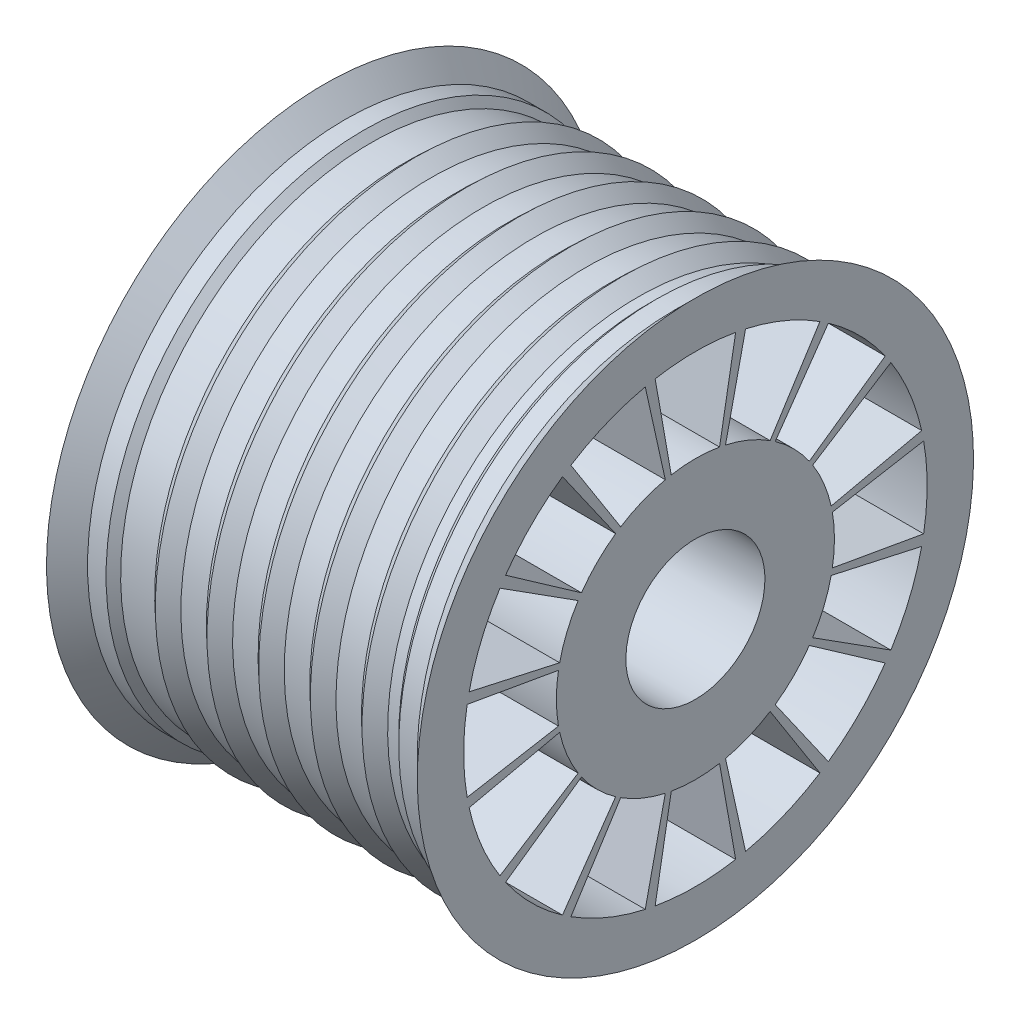
from build123d import *

# Parameters (mm, degrees)
SKETCH3_R             = 7.5
CUT_EXTRUDE1_DEPTH    = 59.309518948
CUT_EXTRUDE4_DEPTH    = 10
CIRPATTERN1_COUNT     = 16
MIRROR2_COPY_1_DEPTH  = 10
MIRROR2_COPY_2_DEPTH  = 10
MIRROR2_COPY_3_DEPTH  = 10
MIRROR2_COPY_4_DEPTH  = 10
MIRROR2_COPY_5_DEPTH  = 10
MIRROR2_COPY_6_DEPTH  = 10
MIRROR2_COPY_7_DEPTH  = 10
MIRROR2_COPY_8_DEPTH  = 10
MIRROR2_COPY_9_DEPTH  = 10
MIRROR2_COPY_10_DEPTH = 10
MIRROR2_COPY_11_DEPTH = 10
MIRROR2_COPY_12_DEPTH = 10
MIRROR2_COPY_13_DEPTH = 10
MIRROR2_COPY_14_DEPTH = 10
MIRROR2_COPY_15_DEPTH = 10
MIRROR2_COPY_16_DEPTH = 10


with BuildPart() as part:
    # Sketch2 → Revolve1 (revolve)
    with BuildSketch(Plane.XY, mode=Mode.PRIVATE) as revolve1_sk:
        Polygon((-20, 0), (-20, 30), (-17.785695345, 27.785695345), (-15.785695345, 27.785695345), (-15, 27), (-11.327571232, 27), (-10.234854429, 28.027604003), (-8.502421292, 27), (-5.751649629, 27), (-4.658932826, 28.027604003), (-2.926499689, 27), (-0.175728026, 27), (0.916988778, 28.027604003), (2.649421915, 27), (5.400193578, 27), (6.492910381, 28.027604003), (8.225343518, 27), (10.976115181, 27), (12.068831985, 28.027604003), (13.801265122, 27), (15, 27), (15.785695345, 27.785695345), (17.785695345, 27.785695345), (20, 30), (20, 0), align=None)
    revolve(revolve1_sk.sketch.rotate(Axis((-20, 0, 0), (1, 0, 0)), 180), axis=Axis((-20, 0, 0), (1, 0, 0)))

    # Sketch3 → Cut-Extrude1 (cut, through all)
    with BuildSketch(Plane.ZY.offset(20)):
        with Locations(Location((0, 0, 0), (0, 0, 270))):
            Circle(SKETCH3_R)
    extrude(amount=-CUT_EXTRUDE1_DEPTH, mode=Mode.SUBTRACT)

    # Sketch4 → Cut-Extrude4 (cut)
    with BuildSketch(Plane.ZY.offset(20)):
        with BuildLine():
            Line((-2.604722665, 14.772116295), (-4.341204442, 24.620193825))
            ThreePointArc((-4.341204442, 24.620193825), (0, 25), (4.341204442, 24.620193825))
            Line((4.341204442, 24.620193825), (2.604722665, 14.772116295))
            ThreePointArc((2.604722665, 14.772116295), (0, 15), (-2.604722665, 14.772116295))
        make_face()
    cut_extrude4 = extrude(amount=-CUT_EXTRUDE4_DEPTH, mode=Mode.SUBTRACT)

    # CirPattern1: Cut-Extrude4 ×16 about axis
    cirpattern1_axis = Axis((0, 0, 0), (1, 0, 0))
    for i in range(1, CIRPATTERN1_COUNT):
        add(cut_extrude4.rotate(cirpattern1_axis, i * 360 / CIRPATTERN1_COUNT), mode=Mode.SUBTRACT)

    # Mirror1: Cut-Extrude4 across plane
    add(cut_extrude4.mirror(Plane(origin=(0, 0, 0), x_dir=(0, 0, 1), z_dir=(1, 0, 0))), mode=Mode.SUBTRACT)

    # Mirror2 copy 1 sketch → Mirror2 copy 1 (cut)
    with BuildSketch(Plane(origin=(20, 0, 0), x_dir=(0, -0.3826834323650898, 0.9238795325112867), z_dir=(1, 0, 0))):
        with BuildLine():
            Line((-2.604722665, -14.772116295), (-4.341204442, -24.620193825))
            ThreePointArc((-4.341204442, -24.620193825), (0, -25), (4.341204442, -24.620193825))
            Line((4.341204442, -24.620193825), (2.604722665, -14.772116295))
            ThreePointArc((2.604722665, -14.772116295), (0, -15), (-2.604722665, -14.772116295))
        make_face()
    extrude(amount=-MIRROR2_COPY_1_DEPTH, mode=Mode.SUBTRACT)

    # Mirror2 copy 2 sketch → Mirror2 copy 2 (cut)
    with BuildSketch(Plane(origin=(20, 0, 0), x_dir=(0, -0.7071067811865475, 0.7071067811865476), z_dir=(1, 0, 0))):
        with BuildLine():
            Line((-2.604722665, -14.772116295), (-4.341204442, -24.620193825))
            ThreePointArc((-4.341204442, -24.620193825), (0, -25), (4.341204442, -24.620193825))
            Line((4.341204442, -24.620193825), (2.604722665, -14.772116295))
            ThreePointArc((2.604722665, -14.772116295), (0, -15), (-2.604722665, -14.772116295))
        make_face()
    extrude(amount=-MIRROR2_COPY_2_DEPTH, mode=Mode.SUBTRACT)

    # Mirror2 copy 3 sketch → Mirror2 copy 3 (cut)
    with BuildSketch(Plane(origin=(20, 0, 0), x_dir=(0, -0.9238795325112867, 0.38268343236508984), z_dir=(1, 0, 0))):
        with BuildLine():
            Line((-2.604722665, -14.772116295), (-4.341204442, -24.620193825))
            ThreePointArc((-4.341204442, -24.620193825), (0, -25), (4.341204442, -24.620193825))
            Line((4.341204442, -24.620193825), (2.604722665, -14.772116295))
            ThreePointArc((2.604722665, -14.772116295), (0, -15), (-2.604722665, -14.772116295))
        make_face()
    extrude(amount=-MIRROR2_COPY_3_DEPTH, mode=Mode.SUBTRACT)

    # Mirror2 copy 4 sketch → Mirror2 copy 4 (cut)
    with BuildSketch(Plane(origin=(20, 0, 0), x_dir=(0, -1, 0), z_dir=(1, 0, 0))):
        with BuildLine():
            Line((-2.604722665, -14.772116295), (-4.341204442, -24.620193825))
            ThreePointArc((-4.341204442, -24.620193825), (0, -25), (4.341204442, -24.620193825))
            Line((4.341204442, -24.620193825), (2.604722665, -14.772116295))
            ThreePointArc((2.604722665, -14.772116295), (0, -15), (-2.604722665, -14.772116295))
        make_face()
    extrude(amount=-MIRROR2_COPY_4_DEPTH, mode=Mode.SUBTRACT)

    # Mirror2 copy 5 sketch → Mirror2 copy 5 (cut)
    with BuildSketch(Plane(origin=(20, 0, 0), x_dir=(0, -0.9238795325112867, -0.3826834323650897), z_dir=(1, 0, 0))):
        with BuildLine():
            Line((-2.604722665, -14.772116295), (-4.341204442, -24.620193825))
            ThreePointArc((-4.341204442, -24.620193825), (0, -25), (4.341204442, -24.620193825))
            Line((4.341204442, -24.620193825), (2.604722665, -14.772116295))
            ThreePointArc((2.604722665, -14.772116295), (0, -15), (-2.604722665, -14.772116295))
        make_face()
    extrude(amount=-MIRROR2_COPY_5_DEPTH, mode=Mode.SUBTRACT)

    # Mirror2 copy 6 sketch → Mirror2 copy 6 (cut)
    with BuildSketch(Plane(origin=(20, 0, 0), x_dir=(0, -0.7071067811865476, -0.7071067811865475), z_dir=(1, 0, 0))):
        with BuildLine():
            Line((-2.604722665, -14.772116295), (-4.341204442, -24.620193825))
            ThreePointArc((-4.341204442, -24.620193825), (0, -25), (4.341204442, -24.620193825))
            Line((4.341204442, -24.620193825), (2.604722665, -14.772116295))
            ThreePointArc((2.604722665, -14.772116295), (0, -15), (-2.604722665, -14.772116295))
        make_face()
    extrude(amount=-MIRROR2_COPY_6_DEPTH, mode=Mode.SUBTRACT)

    # Mirror2 copy 7 sketch → Mirror2 copy 7 (cut)
    with BuildSketch(Plane(origin=(20, 0, 0), x_dir=(0, -0.3826834323650899, -0.9238795325112867), z_dir=(1, 0, 0))):
        with BuildLine():
            Line((-2.604722665, -14.772116295), (-4.341204442, -24.620193825))
            ThreePointArc((-4.341204442, -24.620193825), (0, -25), (4.341204442, -24.620193825))
            Line((4.341204442, -24.620193825), (2.604722665, -14.772116295))
            ThreePointArc((2.604722665, -14.772116295), (0, -15), (-2.604722665, -14.772116295))
        make_face()
    extrude(amount=-MIRROR2_COPY_7_DEPTH, mode=Mode.SUBTRACT)

    # Mirror2 copy 8 sketch → Mirror2 copy 8 (cut)
    with BuildSketch(Plane(origin=(20, 0, 0), x_dir=(0, 0, -1), z_dir=(1, 0, 0))):
        with BuildLine():
            Line((-2.604722665, -14.772116295), (-4.341204442, -24.620193825))
            ThreePointArc((-4.341204442, -24.620193825), (0, -25), (4.341204442, -24.620193825))
            Line((4.341204442, -24.620193825), (2.604722665, -14.772116295))
            ThreePointArc((2.604722665, -14.772116295), (0, -15), (-2.604722665, -14.772116295))
        make_face()
    extrude(amount=-MIRROR2_COPY_8_DEPTH, mode=Mode.SUBTRACT)

    # Mirror2 copy 9 sketch → Mirror2 copy 9 (cut)
    with BuildSketch(Plane(origin=(20, 0, 0), x_dir=(0, 0.38268343236508967, -0.9238795325112868), z_dir=(1, 0, 0))):
        with BuildLine():
            Line((-2.604722665, -14.772116295), (-4.341204442, -24.620193825))
            ThreePointArc((-4.341204442, -24.620193825), (0, -25), (4.341204442, -24.620193825))
            Line((4.341204442, -24.620193825), (2.604722665, -14.772116295))
            ThreePointArc((2.604722665, -14.772116295), (0, -15), (-2.604722665, -14.772116295))
        make_face()
    extrude(amount=-MIRROR2_COPY_9_DEPTH, mode=Mode.SUBTRACT)

    # Mirror2 copy 10 sketch → Mirror2 copy 10 (cut)
    with BuildSketch(Plane(origin=(20, 0, 0), x_dir=(0, 0.7071067811865475, -0.7071067811865477), z_dir=(1, 0, 0))):
        with BuildLine():
            Line((-2.604722665, -14.772116295), (-4.341204442, -24.620193825))
            ThreePointArc((-4.341204442, -24.620193825), (0, -25), (4.341204442, -24.620193825))
            Line((4.341204442, -24.620193825), (2.604722665, -14.772116295))
            ThreePointArc((2.604722665, -14.772116295), (0, -15), (-2.604722665, -14.772116295))
        make_face()
    extrude(amount=-MIRROR2_COPY_10_DEPTH, mode=Mode.SUBTRACT)

    # Mirror2 copy 11 sketch → Mirror2 copy 11 (cut)
    with BuildSketch(Plane(origin=(20, 0, 0), x_dir=(0, 0.9238795325112868, -0.3826834323650895), z_dir=(1, 0, 0))):
        with BuildLine():
            Line((-2.604722665, -14.772116295), (-4.341204442, -24.620193825))
            ThreePointArc((-4.341204442, -24.620193825), (0, -25), (4.341204442, -24.620193825))
            Line((4.341204442, -24.620193825), (2.604722665, -14.772116295))
            ThreePointArc((2.604722665, -14.772116295), (0, -15), (-2.604722665, -14.772116295))
        make_face()
    extrude(amount=-MIRROR2_COPY_11_DEPTH, mode=Mode.SUBTRACT)

    # Mirror2 copy 12 sketch → Mirror2 copy 12 (cut)
    with BuildSketch(Plane.YZ.offset(20)):
        with BuildLine():
            Line((-2.604722665, -14.772116295), (-4.341204442, -24.620193825))
            ThreePointArc((-4.341204442, -24.620193825), (0, -25), (4.341204442, -24.620193825))
            Line((4.341204442, -24.620193825), (2.604722665, -14.772116295))
            ThreePointArc((2.604722665, -14.772116295), (0, -15), (-2.604722665, -14.772116295))
        make_face()
    extrude(amount=-MIRROR2_COPY_12_DEPTH, mode=Mode.SUBTRACT)

    # Mirror2 copy 13 sketch → Mirror2 copy 13 (cut)
    with BuildSketch(Plane(origin=(20, 0, 0), x_dir=(0, 0.9238795325112866, 0.38268343236509), z_dir=(1, 0, 0))):
        with BuildLine():
            Line((-2.604722665, -14.772116295), (-4.341204442, -24.620193825))
            ThreePointArc((-4.341204442, -24.620193825), (0, -25), (4.341204442, -24.620193825))
            Line((4.341204442, -24.620193825), (2.604722665, -14.772116295))
            ThreePointArc((2.604722665, -14.772116295), (0, -15), (-2.604722665, -14.772116295))
        make_face()
    extrude(amount=-MIRROR2_COPY_13_DEPTH, mode=Mode.SUBTRACT)

    # Mirror2 copy 14 sketch → Mirror2 copy 14 (cut)
    with BuildSketch(Plane(origin=(20, 0, 0), x_dir=(0, 0.7071067811865477, 0.7071067811865474), z_dir=(1, 0, 0))):
        with BuildLine():
            Line((-2.604722665, -14.772116295), (-4.341204442, -24.620193825))
            ThreePointArc((-4.341204442, -24.620193825), (0, -25), (4.341204442, -24.620193825))
            Line((4.341204442, -24.620193825), (2.604722665, -14.772116295))
            ThreePointArc((2.604722665, -14.772116295), (0, -15), (-2.604722665, -14.772116295))
        make_face()
    extrude(amount=-MIRROR2_COPY_14_DEPTH, mode=Mode.SUBTRACT)

    # Mirror2 copy 15 sketch → Mirror2 copy 15 (cut)
    with BuildSketch(Plane(origin=(20, 0, 0), x_dir=(0, 0.38268343236508956, 0.9238795325112868), z_dir=(1, 0, 0))):
        with BuildLine():
            Line((-2.604722665, -14.772116295), (-4.341204442, -24.620193825))
            ThreePointArc((-4.341204442, -24.620193825), (0, -25), (4.341204442, -24.620193825))
            Line((4.341204442, -24.620193825), (2.604722665, -14.772116295))
            ThreePointArc((2.604722665, -14.772116295), (0, -15), (-2.604722665, -14.772116295))
        make_face()
    extrude(amount=-MIRROR2_COPY_15_DEPTH, mode=Mode.SUBTRACT)

    # Mirror2 copy 16 sketch → Mirror2 copy 16 (cut)
    with BuildSketch(Plane(origin=(20, 0, 0), x_dir=(0, 0, 1), z_dir=(1, 0, 0))):
        with BuildLine():
            Line((-2.604722665, -14.772116295), (-4.341204442, -24.620193825))
            ThreePointArc((-4.341204442, -24.620193825), (0, -25), (4.341204442, -24.620193825))
            Line((4.341204442, -24.620193825), (2.604722665, -14.772116295))
            ThreePointArc((2.604722665, -14.772116295), (0, -15), (-2.604722665, -14.772116295))
        make_face()
    extrude(amount=-MIRROR2_COPY_16_DEPTH, mode=Mode.SUBTRACT)


solid = part.part
